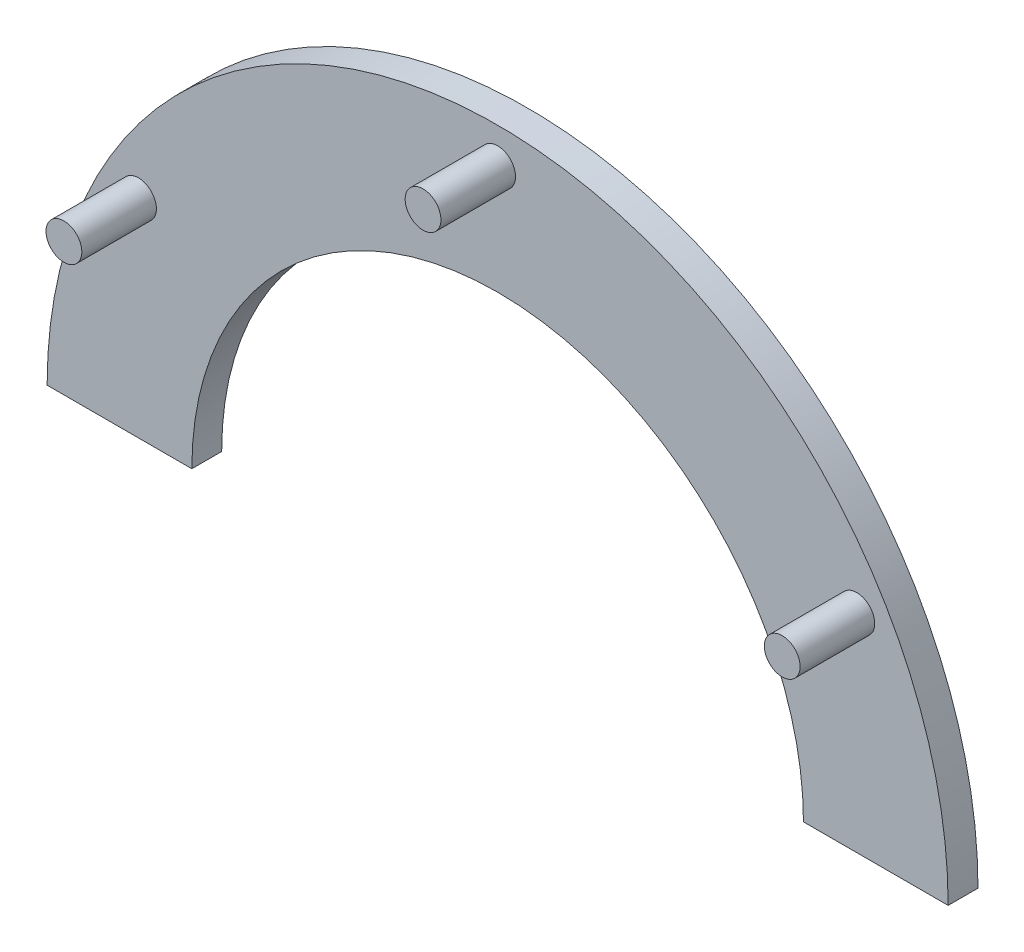
from build123d import *

# Parameters (mm, degrees)
BOSS_EXTRUDE1_DEPTH = 2
SKETCH4_R           = 1.2
BOSS_EXTRUDE2_DEPTH = 7


with BuildPart() as part:
    # Sketch3 → Boss-Extrude1 (new body)
    with BuildSketch(Plane.XY):
        with BuildLine():
            Line((30.2, 0), (20.5, 0))
            ThreePointArc((20.5, 0), (0, 20.5), (-20.5, 0))
            Line((-20.5, 0), (-30.2, 0))
            ThreePointArc((-30.2, 0), (0, 30.2), (30.2, 0))
        make_face()
    extrude(amount=BOSS_EXTRUDE1_DEPTH)

    # Sketch4 → Boss-Extrude2 (add)
    with BuildSketch(Plane(origin=(0, 0, 0), x_dir=(-1, 0, 0), z_dir=(0, 0, -1))):
        with Locations((0, 27.800000001)):
            Circle(SKETCH4_R)
        with Locations((24.075506226, 13.9)):
            Circle(SKETCH4_R)
        with Locations((-24.075506226, 13.9)):
            Circle(SKETCH4_R)
    extrude(amount=-BOSS_EXTRUDE2_DEPTH)


solid = part.part
